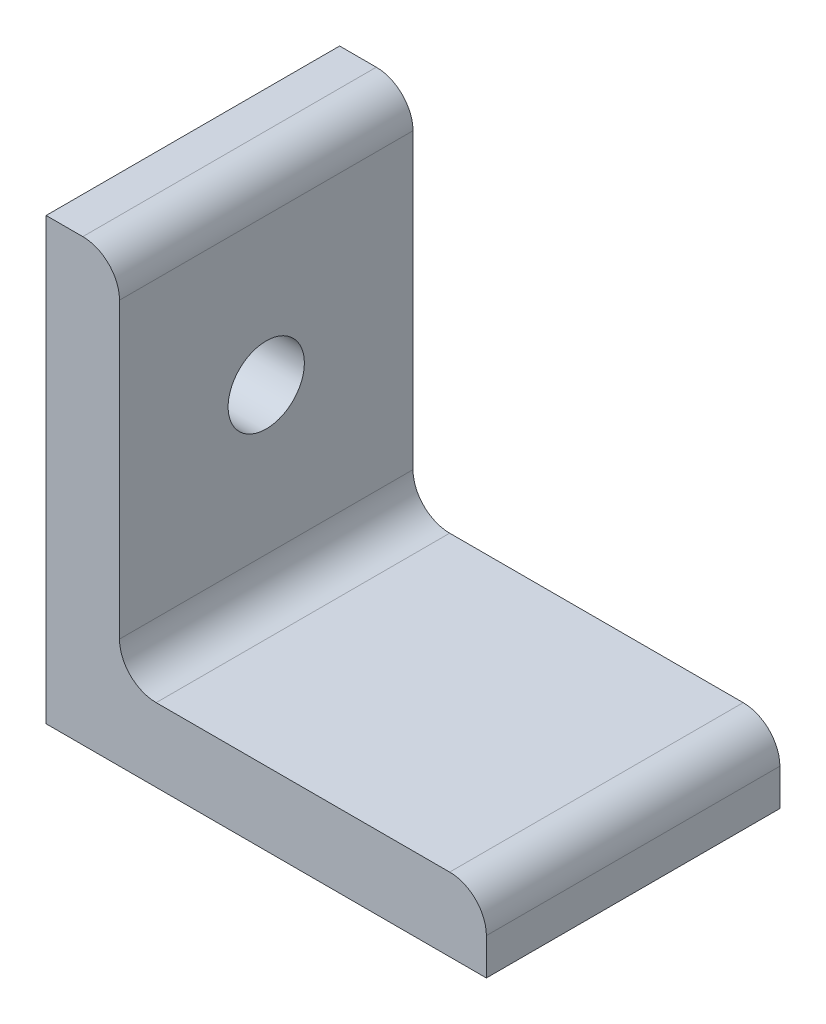
from build123d import *

# Parameters (mm, degrees)
BOSS_EXTRUDE1_DEPTH   = 6.35
FILLET1_R             = 1.5875
M4X0_7_TAPPED_HOLE1_D = 3.3


with BuildPart() as part:
    # Sketch3 → Boss-Extrude1 (new, symmetric)
    with BuildSketch(Plane.XY):
        Polygon((3.175, 19.05), (0, 19.05), (0, 0), (19.05, 0), (19.05, 3.175), (3.175, 3.175), align=None)
    extrude(amount=BOSS_EXTRUDE1_DEPTH, both=True)

    # Fillet1
    fillet1_edges = [part.edges().sort_by_distance(p)[0] for p in [
        (3.175, 3.175, 0),
        (19.05, 3.175, 0),
        (3.175, 19.05, 0),
    ]]
    fillet(fillet1_edges, radius=FILLET1_R)

    # M4x0.7 Tapped Hole1 (through all)
    with Locations(Plane(origin=(3.175, 0, 0), x_dir=(0, 0, -1), z_dir=(1, 0, 0))):
        with Locations((0, 11.1125)):
            Hole(M4X0_7_TAPPED_HOLE1_D / 2)


solid = part.part
